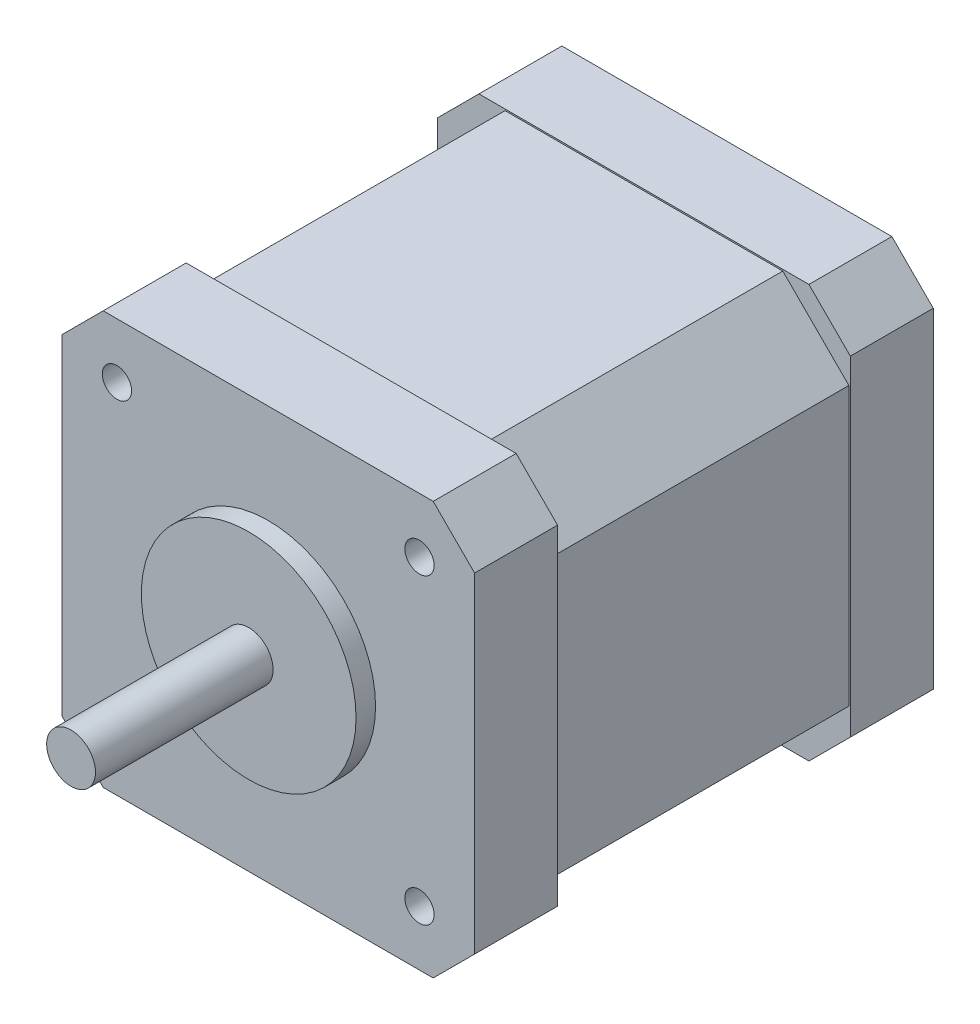
from build123d import *

# Parameters (mm, degrees)
BOSS_EXTRUDE1_DEPTH      = 23.5
BOSS_EXTRUDE1_DEPTH_BACK = 23.5
SKETCH1_R                = 11
SKETCH1_R_2              = 1.5
CUT_EXTRUDE1_DEPTH       = 15
CUT_EXTRUDE1_DEPTH_BACK  = 15
BOSS_EXTRUDE2_DEPTH      = 25.5
BOSS_EXTRUDE2_DEPTH_BACK = 23.5
SKETCH1_9_R              = 11
SKETCH1_9_R_2            = 2.5
BOSS_EXTRUDE3_DEPTH      = 43.7
BOSS_EXTRUDE3_DEPTH_BACK = 23
SKETCH1_10_R             = 2.5
BOSS_EXTRUDE4_DEPTH      = 19.5
BOSS_EXTRUDE4_DEPTH_BACK = 19.5
SKETCH1_11_R             = 1.5


with BuildPart() as part:
    # Sketch1 → Boss-Extrude1 (new, two sides: drawn at the far end of the back side and taken through both)
    with BuildSketch(Plane.XY.offset(-BOSS_EXTRUDE1_DEPTH_BACK)):
        Polygon((-16.907359313, 21.15), (-21.15, 16.907359313), (-21.15, -16.907359313), (-16.907359313, -21.15), (16.907359313, -21.15), (21.15, -16.907359313), (21.15, 16.907359313), (16.907359313, 21.15), align=None)
        Circle(SKETCH1_R, mode=Mode.SUBTRACT)
        with Locations((15.5, 15.5)):
            Circle(SKETCH1_R_2, mode=Mode.SUBTRACT)
        with Locations((-15.5, 15.5)):
            Circle(SKETCH1_R_2, mode=Mode.SUBTRACT)
        with Locations((-15.5, -15.5)):
            Circle(SKETCH1_R_2, mode=Mode.SUBTRACT)
        with Locations((15.5, -15.5)):
            Circle(SKETCH1_R_2, mode=Mode.SUBTRACT)
    extrude(amount=BOSS_EXTRUDE1_DEPTH + BOSS_EXTRUDE1_DEPTH_BACK)

    # Sketch1<8> → Cut-Extrude1 (cut, two sides: drawn at the far end of the back side and taken through both)
    with BuildSketch(Plane.XY.offset(-CUT_EXTRUDE1_DEPTH_BACK)):
        Polygon((-21, 14.228932188), (-21.15, 14.078932188), (-21.15, -14.078932188), (-21, -14.228932188), align=None)
        Polygon((-14.228932188, 21), (-17.057359313, 21), (-21, 17.057359313), (-21, 14.228932188), align=None)
        Polygon((14.078932188, 21.15), (-14.078932188, 21.15), (-14.228932188, 21), (14.228932188, 21), align=None)
        Polygon((17.057359313, 21), (14.228932188, 21), (21, 14.228932188), (21, 17.057359313), align=None)
        Polygon((21.15, 14.078932188), (21, 14.228932188), (21, -14.228932188), (21.15, -14.078932188), align=None)
        Polygon((21, -17.057359313), (21, -14.228932188), (14.228932188, -21), (17.057359313, -21), align=None)
        Polygon((14.228932188, -21), (-14.228932188, -21), (-14.078932188, -21.15), (14.078932188, -21.15), align=None)
        Polygon((17.057359313, -21), (14.228932188, -21), (14.078932188, -21.15), (16.907359313, -21.15), align=None)
        Polygon((21.15, -14.078932188), (21, -14.228932188), (21, -17.057359313), (21.15, -16.907359313), align=None)
        Polygon((16.907359313, 21.15), (14.078932188, 21.15), (14.228932188, 21), (17.057359313, 21), align=None)
        Polygon((21, 17.057359313), (21, 14.228932188), (21.15, 14.078932188), (21.15, 16.907359313), align=None)
        Polygon((-14.078932188, 21.15), (-16.907359313, 21.15), (-17.057359313, 21), (-14.228932188, 21), align=None)
        Polygon((-21, 17.057359313), (-21.15, 16.907359313), (-21.15, 14.078932188), (-21, 14.228932188), align=None)
        Polygon((-14.228932188, -21), (-21, -14.228932188), (-21, -17.057359313), (-17.057359313, -21), align=None)
        Polygon((-21, -14.228932188), (-21.15, -14.078932188), (-21.15, -16.907359313), (-21, -17.057359313), align=None)
        Polygon((-14.078932188, -21.15), (-14.228932188, -21), (-17.057359313, -21), (-16.907359313, -21.15), align=None)
    extrude(amount=CUT_EXTRUDE1_DEPTH + CUT_EXTRUDE1_DEPTH_BACK, mode=Mode.SUBTRACT)

    # Sketch1<9> → Boss-Extrude2 (add, two sides: drawn at the far end of the back side and taken through both)
    with BuildSketch(Plane.XY.offset(-BOSS_EXTRUDE2_DEPTH_BACK)):
        Circle(SKETCH1_9_R)
        Circle(SKETCH1_9_R_2, mode=Mode.SUBTRACT)
    extrude(amount=BOSS_EXTRUDE2_DEPTH + BOSS_EXTRUDE2_DEPTH_BACK)

    # Sketch1<10> → Boss-Extrude3 (add, two sides: drawn at the far end of the back side and taken through both)
    with BuildSketch(Plane.XY.offset(-BOSS_EXTRUDE3_DEPTH_BACK)):
        Circle(SKETCH1_10_R)
    extrude(amount=BOSS_EXTRUDE3_DEPTH + BOSS_EXTRUDE3_DEPTH_BACK)

    # Sketch1<11> → Boss-Extrude4 (add, two sides: drawn at the far end of the back side and taken through both)
    with BuildSketch(Plane.XY.offset(-BOSS_EXTRUDE4_DEPTH_BACK)):
        with Locations((-15.5, -15.5)):
            Circle(SKETCH1_11_R)
        with Locations((-15.5, 15.5)):
            Circle(SKETCH1_11_R)
        with Locations((15.5, 15.5)):
            Circle(SKETCH1_11_R)
        with Locations((15.5, -15.5)):
            Circle(SKETCH1_11_R)
    extrude(amount=BOSS_EXTRUDE4_DEPTH + BOSS_EXTRUDE4_DEPTH_BACK)


solid = part.part
